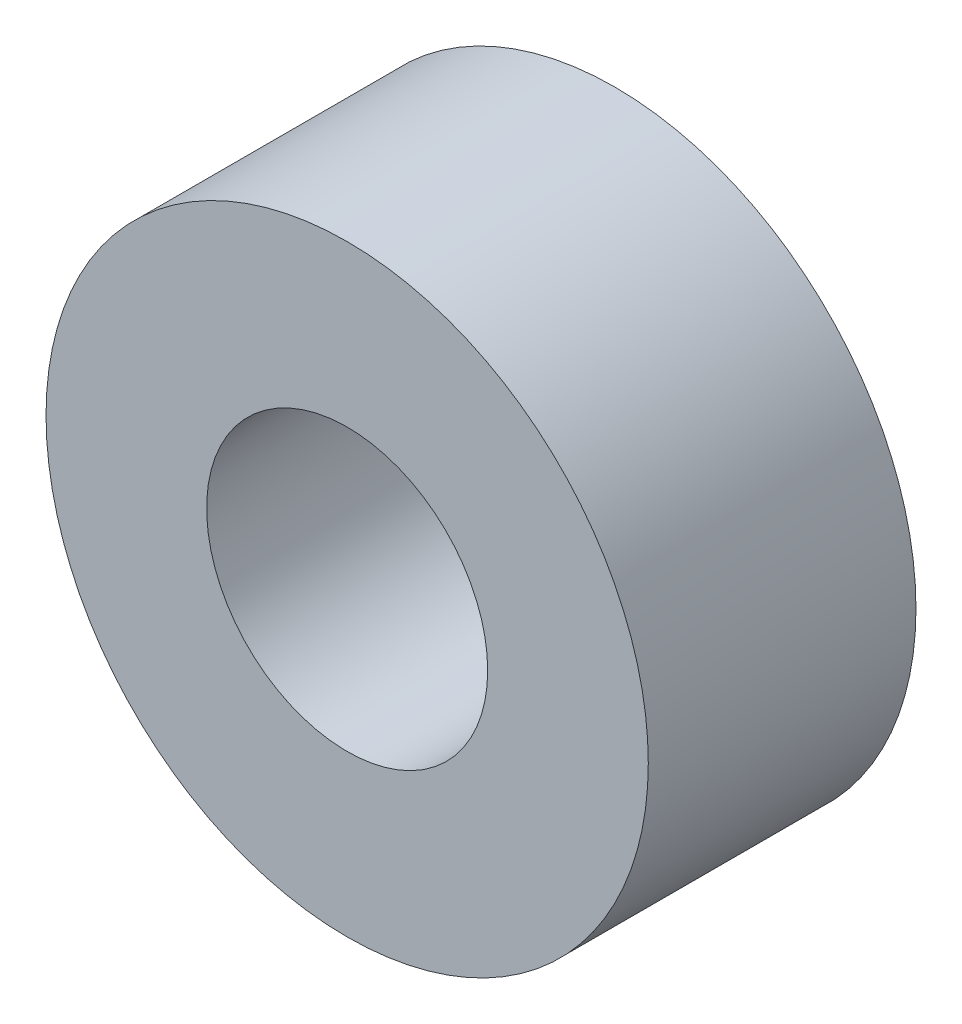
from build123d import *

# Parameters (mm, degrees)
SKETCH1_R           = 4.5
SKETCH1_R_2         = 2.1
BOSS_EXTRUDE1_DEPTH = 4


with BuildPart() as part:
    # Sketch1 → Boss-Extrude1 (new body)
    with BuildSketch(Plane.XY):
        Circle(SKETCH1_R)
        Circle(SKETCH1_R_2, mode=Mode.SUBTRACT)
    extrude(amount=BOSS_EXTRUDE1_DEPTH)


solid = part.part
